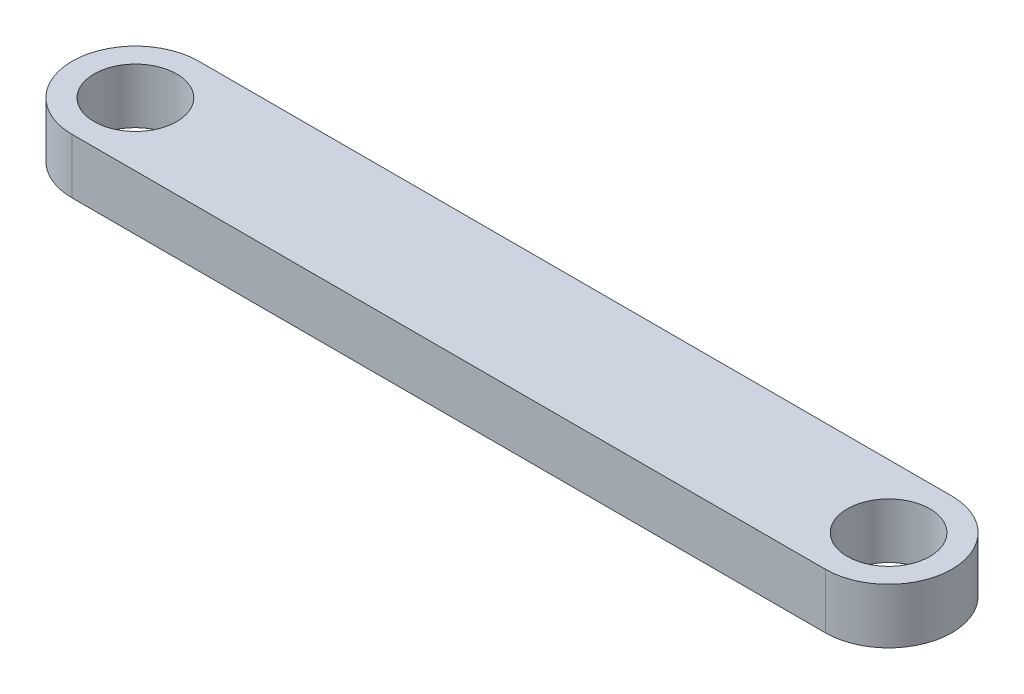
from build123d import *

# Parameters (mm, degrees)
SKETCH1_R           = 3.75
BOSS_EXTRUDE1_DEPTH = 5


with BuildPart() as part:
    # Sketch1 → Boss-Extrude1 (new body)
    with BuildSketch(Plane(origin=(0, 0, 0), x_dir=(1, 0, 0), z_dir=(0, 1, 0))):
        with BuildLine():
            Line((-34.19, -5.75), (34.19, -5.75))
            ThreePointArc((34.19, -5.75), (39.94, 0), (34.19, 5.75))
            Line((34.19, 5.75), (-34.19, 5.75))
            ThreePointArc((-34.19, 5.75), (-39.94, 0), (-34.19, -5.75))
        make_face()
        with Locations(Location((34.19, 0, 0), (0, 0, 270))):
            Circle(SKETCH1_R, mode=Mode.SUBTRACT)
        with Locations(Location((-34.19, 0, 0), (0, 0, 270))):
            Circle(SKETCH1_R, mode=Mode.SUBTRACT)
    extrude(amount=BOSS_EXTRUDE1_DEPTH)


solid = part.part
